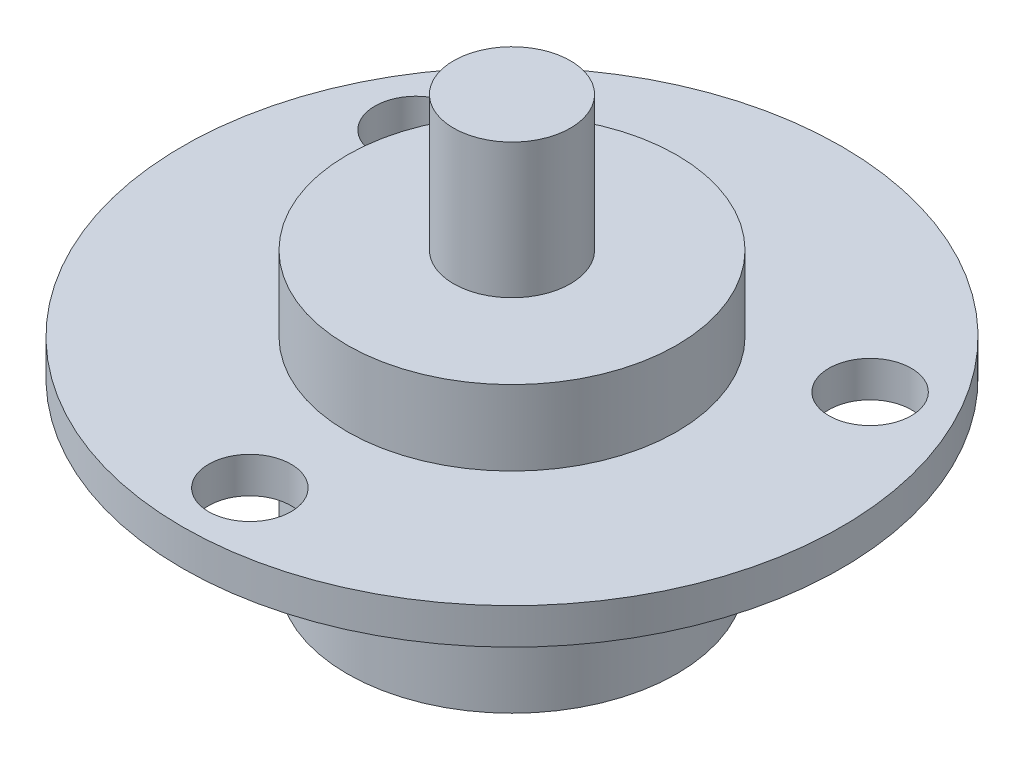
from build123d import *

# Parameters (mm, degrees)
SKETCH1_R           = 11
BOSS_EXTRUDE1_DEPTH = 19
SKETCH2_R           = 3.9
BOSS_EXTRUDE2_DEPTH = 9
SKETCH3_R           = 22
SKETCH3_R_2         = 2.75
BOSS_EXTRUDE3_DEPTH = 2.4


with BuildPart() as part:
    # Sketch1 → Boss-Extrude1 (new body)
    with BuildSketch(Plane(origin=(0, 0, 0), x_dir=(1, 0, 0), z_dir=(0, 1, 0))):
        with Locations(Location((0, 0, 0), (0, 0, 270))):
            Circle(SKETCH1_R)
    extrude(amount=BOSS_EXTRUDE1_DEPTH)

    # Sketch2 → Boss-Extrude2 (add)
    with BuildSketch(Plane(origin=(0, 19, 0), x_dir=(1, 0, 0), z_dir=(0, 1, 0))):
        with Locations(Location((0, 0, 0), (0, 0, 270))):
            Circle(SKETCH2_R)
    extrude(amount=BOSS_EXTRUDE2_DEPTH)

    # Sketch3 → Boss-Extrude3 (add)
    with BuildSketch(Plane(origin=(0, 14, 0), x_dir=(1, 0, 0), z_dir=(0, 1, 0))):
        with Locations(Location((0, 0, 0), (0, 0, 270))):
            Circle(SKETCH3_R)
        with Locations(Location((0, -17.5, 0), (0, 0, 270))):
            Circle(SKETCH3_R_2, mode=Mode.SUBTRACT)
        with Locations(Location((-15.155444566, 8.75, 0), (0, 0, 270))):
            Circle(SKETCH3_R_2, mode=Mode.SUBTRACT)
        with Locations(Location((15.155444566, 8.75, 0), (0, 0, 270))):
            Circle(SKETCH3_R_2, mode=Mode.SUBTRACT)
    extrude(amount=-BOSS_EXTRUDE3_DEPTH)


solid = part.part
